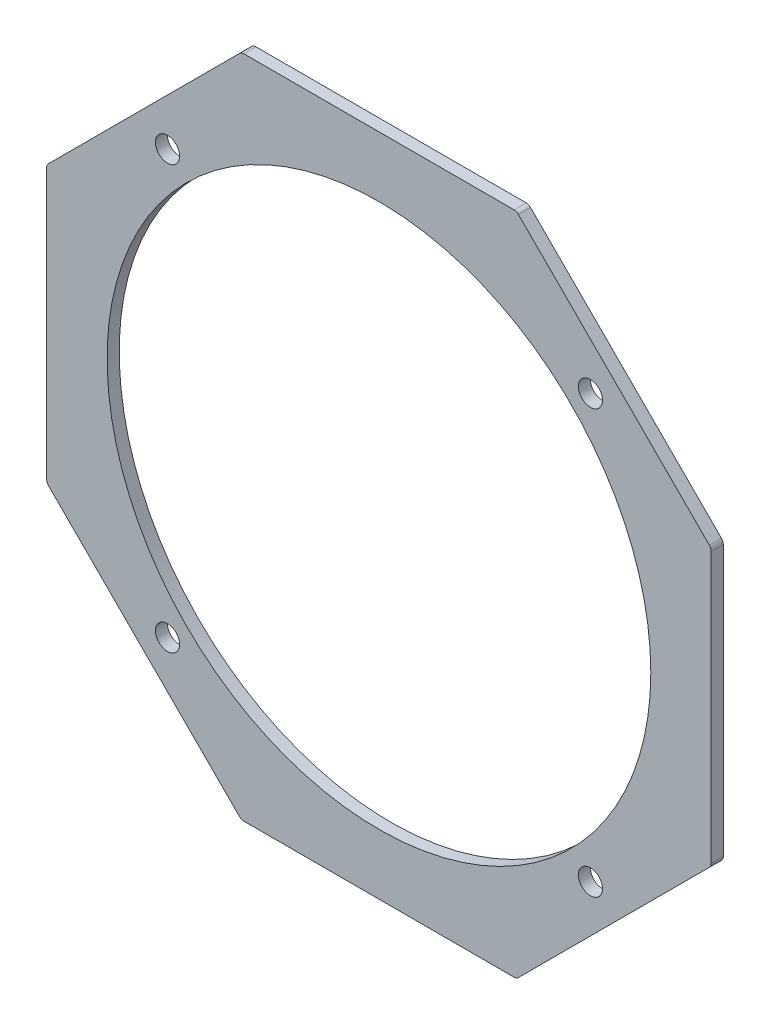
from build123d import *

# Parameters (mm, degrees)
MODEL_R         = 2
MODEL_R_2       = 45
EXTRUDE_1_DEPTH = 2


with BuildPart() as part:
    # Model → 凸台-拉伸1 (new body)
    with BuildSketch(Plane.XY):
        with BuildLine():
            Line((2676.017258653, 2001.48951402), (2631.282193917, 2001.48951402))
            ThreePointArc((2631.282193917, 2001.48951402), (2630.899510484, 2001.413393553), (2630.575087136, 2001.196620802))
            Line((2630.575087136, 2001.196620802), (2598.942619504, 1969.56415317))
            ThreePointArc((2598.942619504, 1969.56415317), (2598.725846752, 1969.239729821), (2598.649726285, 1968.857046389))
            Line((2598.649726285, 1968.857046389), (2598.649726285, 1924.121981652))
            ThreePointArc((2598.649726285, 1924.121981652), (2598.725846752, 1923.73929822), (2598.942619504, 1923.414874871))
            Line((2598.942619504, 1923.414874871), (2630.575087136, 1891.782407239))
            ThreePointArc((2630.575087136, 1891.782407239), (2630.899510484, 1891.565634488), (2631.282193917, 1891.48951402))
            Line((2631.282193917, 1891.48951402), (2676.017258653, 1891.48951402))
            ThreePointArc((2676.017258653, 1891.48951402), (2676.399942085, 1891.565634488), (2676.724365434, 1891.782407239))
            Line((2676.724365434, 1891.782407239), (2708.356833066, 1923.414874871))
            ThreePointArc((2708.356833066, 1923.414874871), (2708.573605817, 1923.73929822), (2708.649726285, 1924.121981652))
            Line((2708.649726285, 1924.121981652), (2708.649726285, 1968.857046389))
            ThreePointArc((2708.649726285, 1968.857046389), (2708.573605817, 1969.239729821), (2708.356833066, 1969.56415317))
            Line((2708.356833066, 1969.56415317), (2676.724365434, 2001.196620802))
            ThreePointArc((2676.724365434, 2001.196620802), (2676.399942085, 2001.413393553), (2676.017258653, 2001.48951402))
        make_face()
        with Locations((2618.647940616, 1911.487728352)):
            Circle(MODEL_R, mode=Mode.SUBTRACT)
        with Locations((2688.651511954, 1981.491299689)):
            Circle(MODEL_R, mode=Mode.SUBTRACT)
        with Locations((2618.647940616, 1981.491299689)):
            Circle(MODEL_R, mode=Mode.SUBTRACT)
        with Locations((2688.651511954, 1911.487728352)):
            Circle(MODEL_R, mode=Mode.SUBTRACT)
        with Locations((2653.649726285, 1946.48951402)):
            Circle(MODEL_R_2, mode=Mode.SUBTRACT)
    extrude(amount=EXTRUDE_1_DEPTH)


solid = part.part
